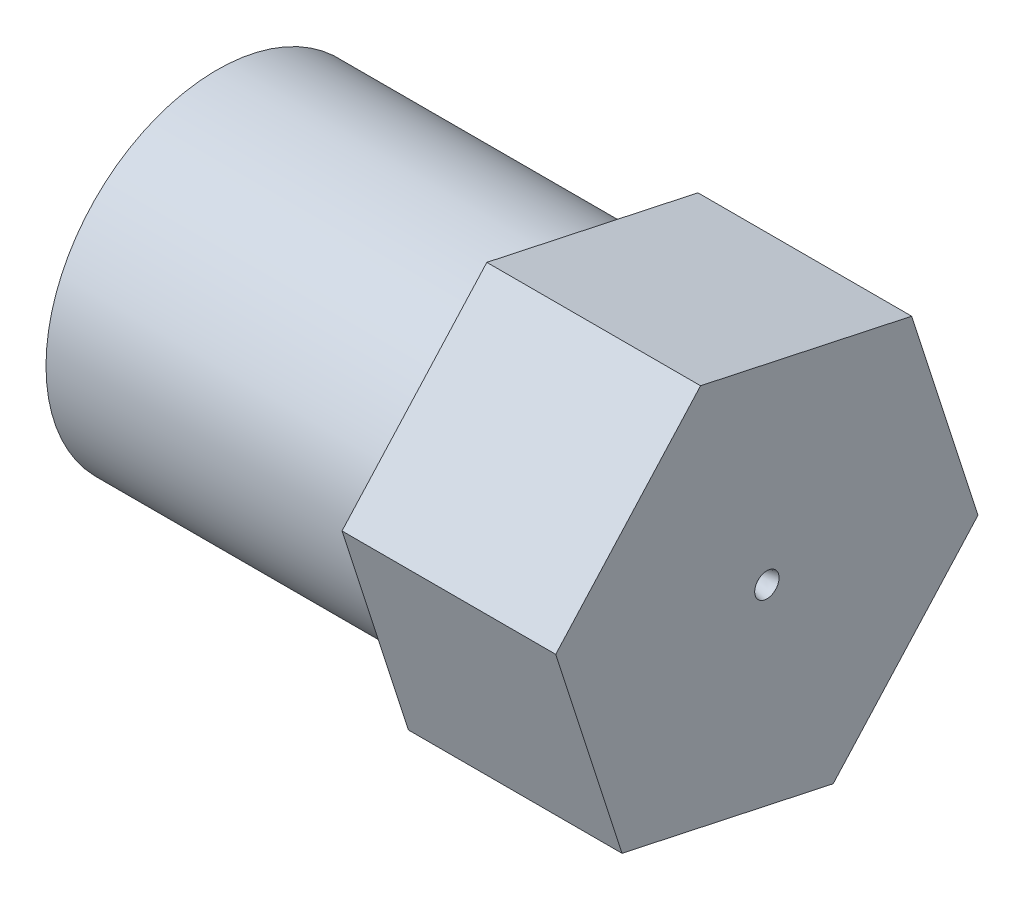
from build123d import *

# Parameters (mm, degrees)
SKETCH4_R           = 10.16
BOSS_EXTRUDE1_DEPTH = 12.7
FILLET1_R           = 0.635


with BuildPart() as part:
    # Sketch1 → Revolve1 (revolve)
    with BuildSketch(Plane.XY, mode=Mode.PRIVATE) as revolve1_sk:
        with BuildLine():
            Line((-0.530330086, 0.719669914), (-3.325724202, 3.51506403))
            ThreePointArc((-3.325724202, 3.51506403), (-4.355768335, 4.203317516), (-5.570788232, 4.445))
            Line((-5.570788232, 4.445), (-13.462, 4.445))
            Line((-13.462, 4.445), (-13.462, 4.699))
            ThreePointArc((-13.462, 4.699), (-13.499197439, 4.788802561), (-13.589, 4.826))
            Line((-13.589, 4.826), (-19.304, 4.826))
            ThreePointArc((-19.304, 4.826), (-19.753012806, 5.011987194), (-19.939, 5.461))
            Line((-19.939, 5.461), (-19.939, 6.8199))
            ThreePointArc((-19.939, 6.8199), (-19.976197439, 6.909702561), (-20.066, 6.9469))
            Line((-20.066, 6.9469), (-24.892, 6.9469))
            Line((-24.892, 6.9469), (-24.892, 7.8994))
            ThreePointArc((-24.892, 7.8994), (-24.929197439, 7.989202561), (-25.019, 8.0264))
            Line((-25.019, 8.0264), (-31.115, 8.0264))
            ThreePointArc((-31.115, 8.0264), (-31.564012806, 8.212387194), (-31.75, 8.6614))
            Line((-31.75, 8.6614), (-31.75, 10.16))
            Line((-31.75, 10.16), (-11.775039932, 10.16))
            Line((-11.775039932, 10.16), (0.924960068, 10.16))
            Line((0.924960068, 10.16), (0.924960068, 0.724568837))
            add(Edge.make_bspline(
                [(0.924960068, 0.724568837), (0.48073231, 0.662136702), (0.068404027, 0.51206148)],
                knots=[0, 0, 0, 1, 1, 1], degree=2))
            ThreePointArc((0.068404027, 0.51206148), (0.034729636, 0.503038449), (0, 0.5))
            ThreePointArc((0, 0.5), (-0.287012574, 0.557090351), (-0.530330086, 0.719669914))
        make_face()
    revolve(revolve1_sk.sketch.rotate(Axis((0, 0, 0), (1, 0, 0)), 90), axis=Axis((0, 0, 0), (1, 0, 0)))

    # Sketch4 → Boss-Extrude1 (add)
    with BuildSketch(Plane(origin=(0.924960068, 0, 0), x_dir=(0, 0, -1), z_dir=(1, 0, 0))):
        Polygon((3.940411868, -12.211607701), (12.545768424, -2.693307071), (8.605356556, 9.51830063), (-3.940411868, 12.211607701), (-12.545768424, 2.693307071), (-8.605356556, -9.51830063), align=None)
        with Locations(Location((0, 0, 0), (0, 0, 180))):
            Circle(SKETCH4_R, mode=Mode.SUBTRACT)
    extrude(amount=-BOSS_EXTRUDE1_DEPTH)

    # Fillet1
    fillet1_edges = [part.edges().sort_by_distance(p)[0] for p in [
        (-11.775039932, 0, -10.16),
    ]]
    fillet(fillet1_edges, radius=FILLET1_R)


solid = part.part
